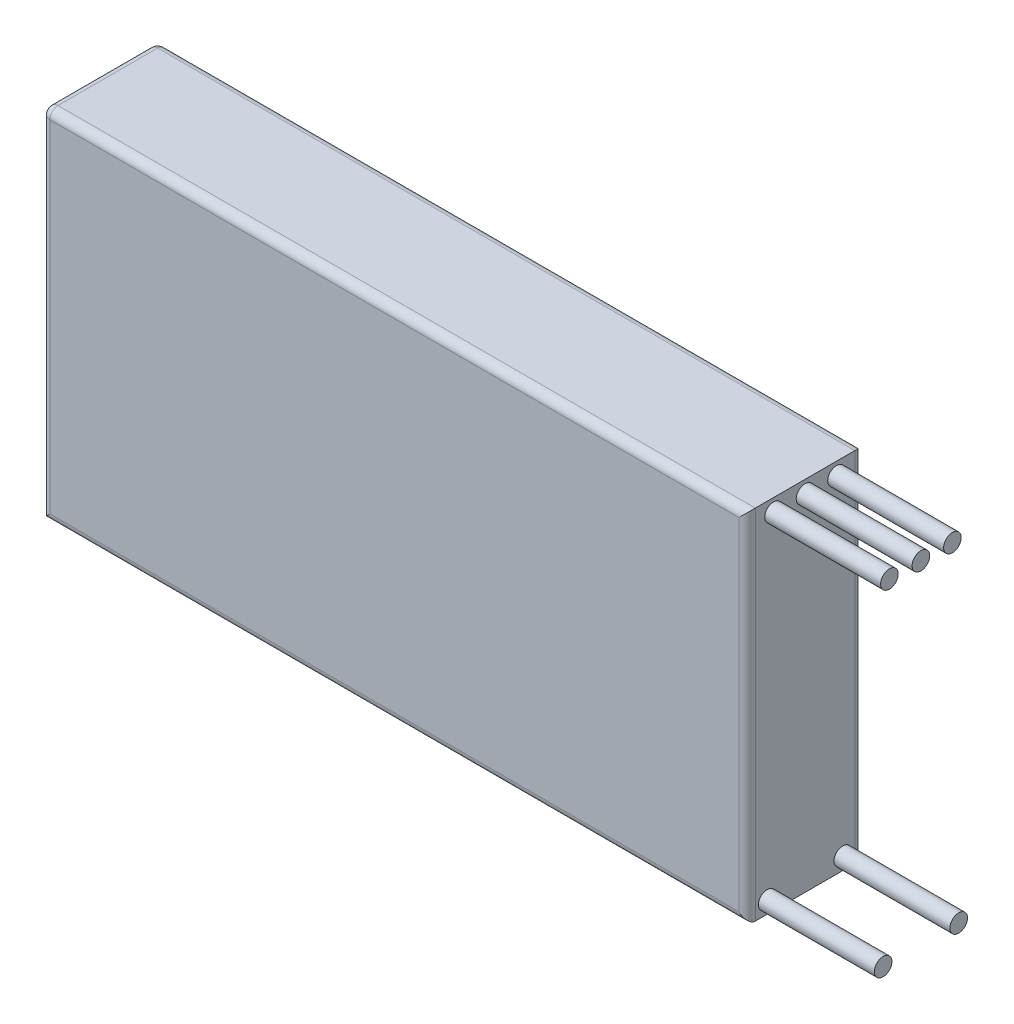
from build123d import *

# Parameters (mm, degrees)
SKETCH1_W           = 71.12
SKETCH1_H           = 36.068
BOSS_EXTRUDE1_DEPTH = 11.684
SKETCH2_R           = 0.889
BOSS_EXTRUDE2_DEPTH = 11.684
FILLET1_R           = 0.8255


with BuildPart() as part:
    # Sketch1 → Boss-Extrude1 (new body)
    with BuildSketch(Plane.XY):
        with Locations((35.56, 18.034)):
            Rectangle(SKETCH1_W, SKETCH1_H)
    extrude(amount=BOSS_EXTRUDE1_DEPTH)

    # Sketch2 → Boss-Extrude2 (add)
    with BuildSketch(Plane(origin=(71.12, 0, 0), x_dir=(0, 0, -1), z_dir=(1, 0, 0))):
        with Locations(Location((-9.652, 1.27, 0), (0, 0, 180))):
            Circle(SKETCH2_R)
        with Locations(Location((-2.032, 1.27, 0), (0, 0, 180))):
            Circle(SKETCH2_R)
        with Locations(Location((-9.017, 34.798, 0), (0, 0, 180))):
            Circle(SKETCH2_R)
        with Locations(Location((-5.842, 34.798, 0), (0, 0, 180))):
            Circle(SKETCH2_R)
        with Locations(Location((-2.667, 34.798, 0), (0, 0, 180))):
            Circle(SKETCH2_R)
    extrude(amount=BOSS_EXTRUDE2_DEPTH)

    # Fillet1
    fillet1_edges = [part.edges().sort_by_distance(p)[0] for p in [
        (71.12, 18.034, 11.684),
        (35.56, 36.068, 11.684),
        (0, 18.034, 11.684),
        (35.56, 36.068, 0),
        (71.12, 18.034, 0),
        (35.56, 0, 0),
        (0, 18.034, 0),
        (0, 36.068, 5.842),
        (35.56, 0, 11.684),
    ]]
    fillet(fillet1_edges, radius=FILLET1_R)


solid = part.part
